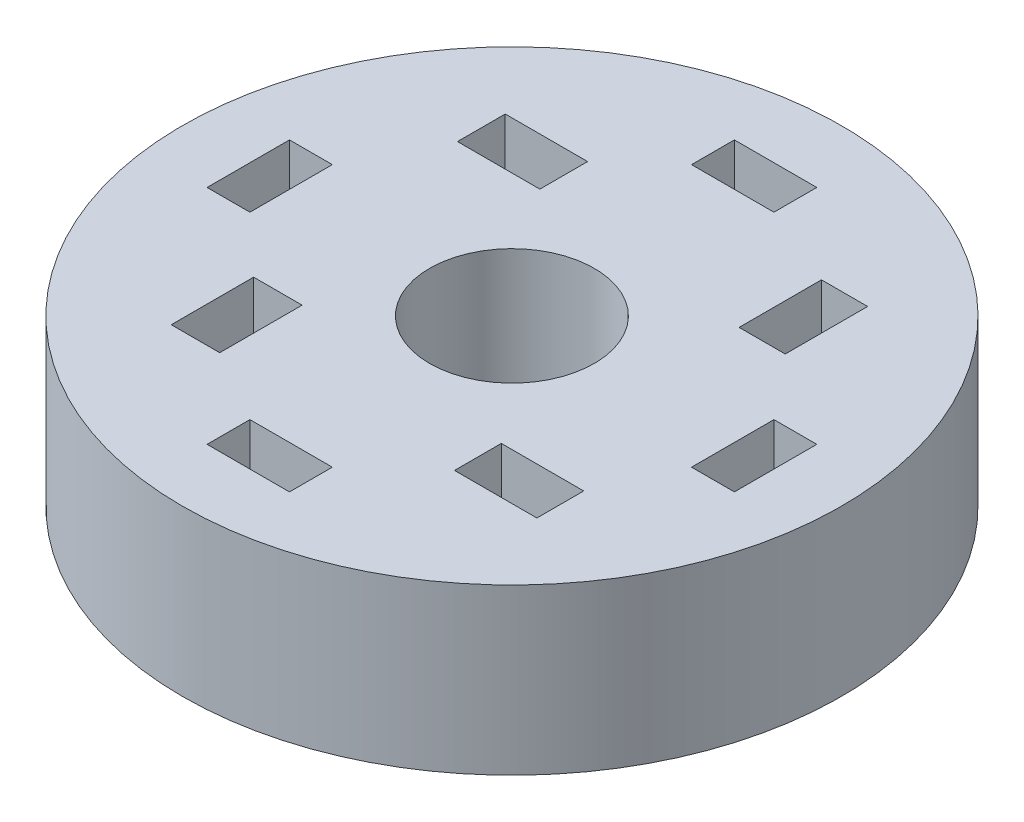
from build123d import *

# Parameters (mm, degrees)
SKETCH_1_R      = 20
SKETCH_1_R_2    = 5
SKETCH_1_W      = 5
SKETCH_1_H      = 2.6
SKETCH_1_W_2    = 2.6
SKETCH_1_H_2    = 5
SKETCH_1_W_3    = 2.8
SKETCH_1_W_4    = 2.941603816
SKETCH_1_H_3    = 2.897870759
SKETCH_1_H_4    = 2.841528046
EXTRUDE_1_DEPTH = 10


with BuildPart() as part:
    # Эскиз1 → Бобышка-Вытянуть1 (new body)
    with BuildSketch(Plane(origin=(0, 0, 0), x_dir=(1, 0, 0), z_dir=(0, 1, 0))):
        with Locations(Location((0, 0, 0), (0, 0, 270))):
            Circle(SKETCH_1_R)
        with Locations(Location((0, 0, 0), (0, 0, 270))):
            Circle(SKETCH_1_R_2, mode=Mode.SUBTRACT)
        with Locations((0, -14.7)):
            Rectangle(SKETCH_1_W, SKETCH_1_H, mode=Mode.SUBTRACT)
        with Locations((-14.7, 0)):
            Rectangle(SKETCH_1_W_2, SKETCH_1_H_2, mode=Mode.SUBTRACT)
        with Locations((14.7, 0)):
            Rectangle(SKETCH_1_W_2, SKETCH_1_H_2, mode=Mode.SUBTRACT)
        with Locations((0, 14.7)):
            Rectangle(SKETCH_1_W, SKETCH_1_H, mode=Mode.SUBTRACT)
        with Locations((8.896405813, 8.788682263)):
            Rectangle(SKETCH_1_W_3, SKETCH_1_H_2, mode=Mode.SUBTRACT)
        with Locations((-8.402919516, -8.301171423)):
            Rectangle(SKETCH_1_W_4, SKETCH_1_H_2, mode=Mode.SUBTRACT)
        with Locations((-8.314700298, 8.958870068)):
            Rectangle(SKETCH_1_W, SKETCH_1_H_3, mode=Mode.SUBTRACT)
        with Locations((8.878230894, -8.443187871)):
            Rectangle(SKETCH_1_W, SKETCH_1_H_4, mode=Mode.SUBTRACT)
    extrude(amount=EXTRUDE_1_DEPTH)


solid = part.part
